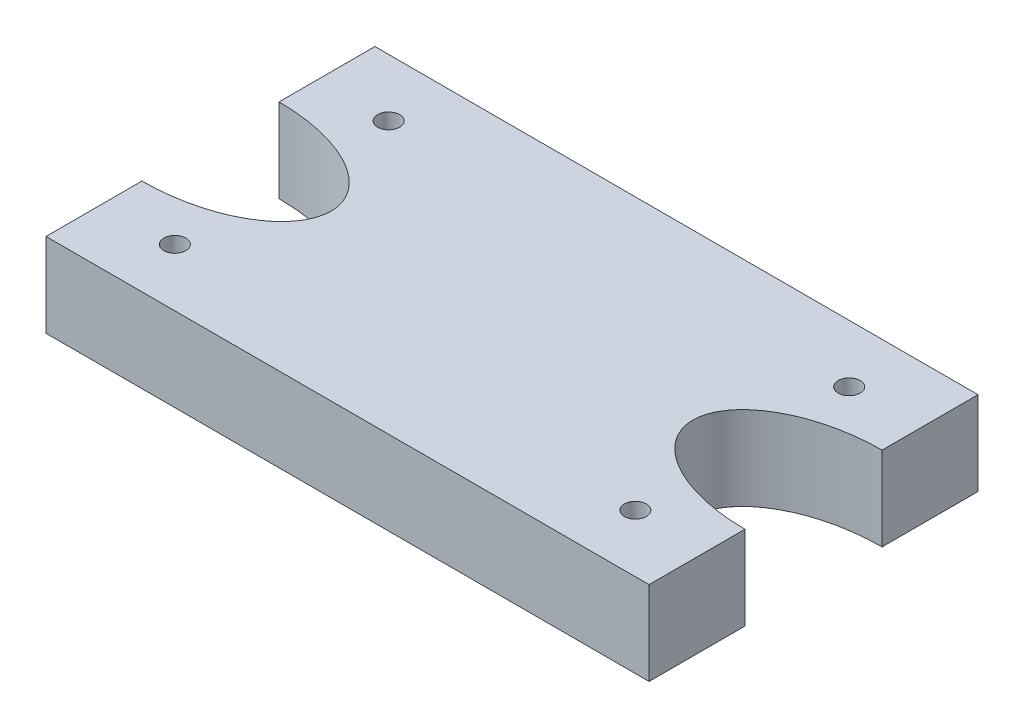
from build123d import *

# Parameters (mm, degrees)
ESQUISSE1_W             = 110
ESQUISSE1_H             = 60
BOSS_EXTRU_1_DEPTH      = 15.3
ESQUISSE2_R             = 2
ENL_V_MAT_EXTRU_2_DEPTH = 87.616374477
ESQUISSE5_RX            = 22
ESQUISSE5_RY            = 12.5
ENL_V_MAT_EXTRU_4_DEPTH = 87.616374477


with BuildPart() as part:
    # Esquisse1 → Boss.-Extru.1 (new body)
    with BuildSketch(Plane(origin=(0, 0, 0), x_dir=(1, 0, 0), z_dir=(0, 1, 0))):
        with Locations((19.731995919, -11.029685758)):
            Rectangle(ESQUISSE1_W, ESQUISSE1_H)
    extrude(amount=BOSS_EXTRU_1_DEPTH)

    # Esquisse2 → Enlèv. mat.-Extru.2 (cut, through all)
    with BuildSketch(Plane(origin=(0, 15.3, 0), x_dir=(1, 0, 0), z_dir=(0, 1, 0))):
        with Locations(Location((61.731995919, 8.470314242, 0), (0, 0, 270))):
            Circle(ESQUISSE2_R)
        with Locations(Location((61.731995919, -30.529685758, 0), (0, 0, 270))):
            Circle(ESQUISSE2_R)
        with Locations(Location((-22.268004081, 8.470314242, 0), (0, 0, 270))):
            Circle(ESQUISSE2_R)
        with Locations(Location((-22.268004081, -30.529685758, 0), (0, 0, 270))):
            Circle(ESQUISSE2_R)
    extrude(amount=-ENL_V_MAT_EXTRU_2_DEPTH, mode=Mode.SUBTRACT)

    # Esquisse5 → Enlèv. mat.-Extru.4 (cut, through all)
    with BuildSketch(Plane(origin=(0, 15.3, 0), x_dir=(1, 0, 0), z_dir=(0, 1, 0))):
        with Locations((-35.268004081, -11.029685758)):
            Ellipse(ESQUISSE5_RX, ESQUISSE5_RY)
        with Locations(Location((74.731995919, -11.029685758), (0, 0, 180))):
            Ellipse(ESQUISSE5_RX, ESQUISSE5_RY)
    extrude(amount=-ENL_V_MAT_EXTRU_4_DEPTH, mode=Mode.SUBTRACT)


solid = part.part
